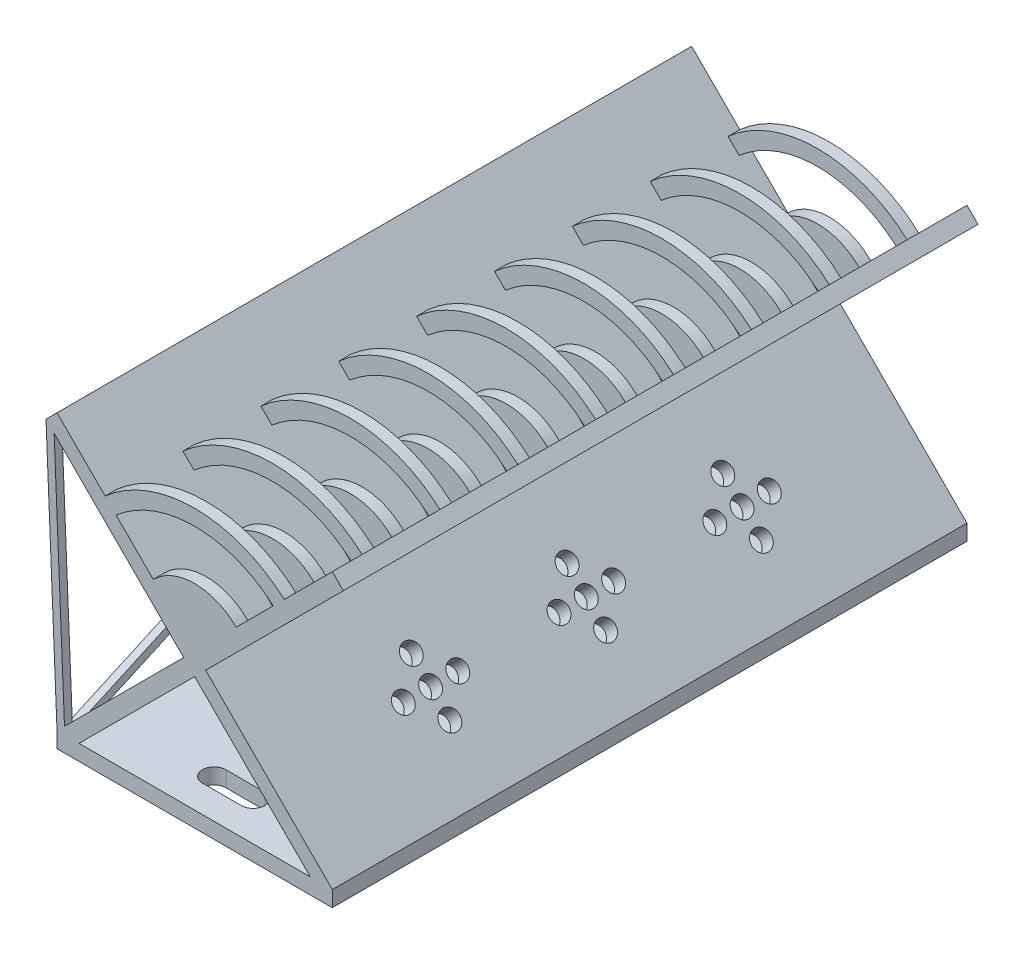
from build123d import *

# Parameters (mm, degrees)
FRAME_DEPTH                          = 207.01
FRAME_2_DEPTH                        = 207.01
SKETCH12_W                           = 89.80256121
SKETCH12_H                           = 5.113031494
BOTTOM_PLATFORM_DEPTH                = 207.01
SKETCH13_R                           = 3.81
RUBBER_PADS_1_DEPTH                  = 3.81
RUBBER_PADS_1_TAPER                  = 10
SKETCH15_R                           = 3.81
RUBBER_PADS_2_DEPTH                  = 3.81
RUBBER_PADS_2_TAPER                  = 10
CABLE_HOLES_REACH                    = 234.838
BOTTOM_SEPARATORS_DEPTH              = 3.81
BOTTOM_SEPARATORS_PATTERN_COUNT      = 9
BOTTOM_SEPARATORS_PATTERN_PITCH      = 25.4
TOP_SEPARATORS_DEPTH                 = 3.81
TOP_SEPARATORS_PATTERN_COUNT         = 9
TOP_SEPARATORS_PATTERN_PITCH         = 25.4
SPEAKER_HOLES_REACH                  = 221.321
SKETCH27_R                           = 3.175
SPEAKER_HOLES_PATTERN_1_COUNT        = 2
SPEAKER_HOLES_PATTERN_1_PITCH        = 50.8
SPEAKER_HOLES_PATTERN_2_COUNT        = 2
SPEAKER_HOLES_PATTERN_2_PITCH        = 50.8
SPEAKER_HOLES_MIRROR_COPY_1_REACH    = 221.321
SPEAKER_HOLES_MIRROR_COPY_1_SKETCH_R = 3.175
SPEAKER_HOLES_MIRROR_COPY_2_REACH    = 221.321
SPEAKER_HOLES_MIRROR_COPY_2_SKETCH_R = 3.175
EXTRUDE_THIN2_DEPTH                  = 2.54
EXTRUDE_THIN5_DEPTH                  = 2.54
EXTRUDE_THIN9_DEPTH                  = 2.54


with BuildPart() as part:
    # Sketch1 → Frame (new body)
    with BuildSketch(Plane.XY):
        Polygon((-44.901280605, 44.901280605), (44.901280605, -44.901280605), (41.309178157, -48.493383054), (-48.493383054, 41.309178157), align=None)
    extrude(amount=FRAME_DEPTH)



with BuildPart() as body_2:
    # Sketch1 → Frame 2 (new body)
    with BuildSketch(Plane.XY):
        Polygon((-44.901280605, -44.901280605), (44.901280605, 44.901280605), (48.493383054, 41.309178157), (-41.309178157, -48.493383054), align=None)
    extrude(amount=FRAME_2_DEPTH)


with BuildPart() as part_1:
    add(part.part)

    add(body_2.part)  # Bottom Platform merges body 2
    # Sketch12 → Bottom Platform (add)
    with BuildSketch(Plane.XY):
        with Locations((0, -47.457796352)):
            Rectangle(SKETCH12_W, SKETCH12_H)
    extrude(amount=BOTTOM_PLATFORM_DEPTH)

    # Sketch13 → Rubber Pads 1 (add)
    with BuildSketch(Plane(origin=(0, -50.014312099, 0), x_dir=(-1, 0, 0), z_dir=(0, -1, 0))):
        with Locations((32.201280605, -194.31)):
            Circle(SKETCH13_R)
    rubber_pads_1 = extrude(amount=RUBBER_PADS_1_DEPTH, taper=RUBBER_PADS_1_TAPER)

    # Rubber Pads 1 Mirror: Rubber Pads 1 across plane
    add(rubber_pads_1.mirror(Plane(origin=(0, 0, 0), x_dir=(0, 0, 1), z_dir=(1, 0, 0))))

    # Sketch15 → Rubber Pads 2 (add)
    with BuildSketch(Plane.XZ.offset(50.014312099)):
        with Locations((32.201280605, 12.7)):
            Circle(SKETCH15_R)
    rubber_pads_2 = extrude(amount=RUBBER_PADS_2_DEPTH, taper=RUBBER_PADS_2_TAPER)

    # Rubber Pads 2 Mirror: Rubber Pads 2 across plane
    add(rubber_pads_2.mirror(Plane(origin=(0, 0, 0), x_dir=(0, 0, 1), z_dir=(1, 0, 0))))

    # Sketch21 → Cable Holes (cut, up to next)
    with BuildSketch(Plane.XZ.offset(50.014312099), mode=Mode.PRIVATE) as cable_holes_sk1:
        with BuildLine():
            Line((6.35, 8.89), (-6.35, 8.89))
            ThreePointArc((-6.35, 8.89), (-10.16, 12.7), (-6.35, 16.51))
            Line((-6.35, 16.51), (6.35, 16.51))
            ThreePointArc((6.35, 16.51), (10.16, 12.7), (6.35, 8.89))
        make_face()
    cable_holes_tool1 = extrude(cable_holes_sk1.sketch, amount=-CABLE_HOLES_REACH, mode=Mode.PRIVATE) & part_1.part
    # Sketch21 → Cable Holes (cut, up to next)
    with BuildSketch(Plane.XZ.offset(50.014312099), mode=Mode.PRIVATE) as cable_holes_sk2:
        with BuildLine():
            Line((6.35, 190.5), (-6.35, 190.5))
            ThreePointArc((-6.35, 190.5), (-10.16, 194.31), (-6.35, 198.12))
            Line((-6.35, 198.12), (6.35, 198.12))
            ThreePointArc((6.35, 198.12), (10.16, 194.31), (6.35, 190.5))
        make_face()
    cable_holes_tool2 = extrude(cable_holes_sk2.sketch, amount=-CABLE_HOLES_REACH, mode=Mode.PRIVATE) & part_1.part
    add(cable_holes_tool1.solids().sort_by_distance((0, -50.014312, 12.7))[0], mode=Mode.SUBTRACT)
    add(cable_holes_tool2.solids().sort_by_distance((0, -50.014312, 194.31))[0], mode=Mode.SUBTRACT)

    # Sketch23 → Bottom Separators (add)
    with BuildSketch(Plane.XY.offset(207.01)):
        with BuildLine():
            Line((13.516185422, 13.516185422), (0, 0))
            Line((0, 0), (-13.516185422, 13.516185422))
            ThreePointArc((-13.516185422, 13.516185422), (0, 19.114772736), (13.516185422, 13.516185422))
        make_face()
    bottom_separators = extrude(amount=-BOTTOM_SEPARATORS_DEPTH)

    # Bottom Separators Pattern: Bottom Separators ×9
    with Locations(*[(0, 0, -i * BOTTOM_SEPARATORS_PATTERN_PITCH) for i in range(1, BOTTOM_SEPARATORS_PATTERN_COUNT)]):
        add(bottom_separators)

    # Sketch25 → Top Separators (add)
    with BuildSketch(Plane.XY.offset(207.01)):
        with BuildLine():
            Line((-29.208733014, 29.208733014), (-25.616630565, 25.616630565))
            ThreePointArc((-25.616630565, 25.616630565), (0, 35.281810324), (25.616630565, 25.616630565))
            Line((25.616630565, 25.616630565), (29.208733014, 29.208733014))
            ThreePointArc((29.208733014, 29.208733014), (0, 40.361810324), (-29.208733014, 29.208733014))
        make_face()
    top_separators = extrude(amount=-TOP_SEPARATORS_DEPTH)

    # Top Separators Pattern: Top Separators ×9
    with Locations(*[(0, 0, -i * TOP_SEPARATORS_PATTERN_PITCH) for i in range(1, TOP_SEPARATORS_PATTERN_COUNT)]):
        add(top_separators)

    # Sketch27 → Speaker Holes (cut, up to next)
    with BuildSketch(Plane(origin=(0, 0, 0), x_dir=(0, 0, -1), z_dir=(0.7071067811865533, 0.7071067811865418, 0)), mode=Mode.PRIVATE) as speaker_holes_sk1:
        with Locations(Location((-112.395, -34.29, 0), (0, 0, 90))):
            Circle(SKETCH27_R)
    speaker_holes_tool1 = extrude(speaker_holes_sk1.sketch, amount=-SPEAKER_HOLES_REACH, mode=Mode.PRIVATE) & part_1.part
    # Sketch27 → Speaker Holes (cut, up to next)
    with BuildSketch(Plane(origin=(0, 0, 0), x_dir=(0, 0, -1), z_dir=(0.7071067811865533, 0.7071067811865418, 0)), mode=Mode.PRIVATE) as speaker_holes_sk2:
        with Locations(Location((-103.505, -34.29, 0), (0, 0, 90))):
            Circle(SKETCH27_R)
    speaker_holes_tool2 = extrude(speaker_holes_sk2.sketch, amount=-SPEAKER_HOLES_REACH, mode=Mode.PRIVATE) & part_1.part
    # Sketch27 → Speaker Holes (cut, up to next)
    with BuildSketch(Plane(origin=(0, 0, 0), x_dir=(0, 0, -1), z_dir=(0.7071067811865533, 0.7071067811865418, 0)), mode=Mode.PRIVATE) as speaker_holes_sk3:
        with Locations(Location((-94.615, -34.29, 0), (0, 0, 90))):
            Circle(SKETCH27_R)
    speaker_holes_tool3 = extrude(speaker_holes_sk3.sketch, amount=-SPEAKER_HOLES_REACH, mode=Mode.PRIVATE) & part_1.part
    # Sketch27 → Speaker Holes (cut, up to next)
    with BuildSketch(Plane(origin=(0, 0, 0), x_dir=(0, 0, -1), z_dir=(0.7071067811865533, 0.7071067811865418, 0)), mode=Mode.PRIVATE) as speaker_holes_sk4:
        with Locations(Location((-103.505, -25.4, 0), (0, 0, 90))):
            Circle(SKETCH27_R)
    speaker_holes_tool4 = extrude(speaker_holes_sk4.sketch, amount=-SPEAKER_HOLES_REACH, mode=Mode.PRIVATE) & part_1.part
    # Sketch27 → Speaker Holes (cut, up to next)
    with BuildSketch(Plane(origin=(0, 0, 0), x_dir=(0, 0, -1), z_dir=(0.7071067811865533, 0.7071067811865418, 0)), mode=Mode.PRIVATE) as speaker_holes_sk5:
        with Locations(Location((-103.505, -43.18, 0), (0, 0, 90))):
            Circle(SKETCH27_R)
    speaker_holes_tool5 = extrude(speaker_holes_sk5.sketch, amount=-SPEAKER_HOLES_REACH, mode=Mode.PRIVATE) & part_1.part
    speaker_holes_1 = speaker_holes_tool1.solids().sort_by_distance((24.246692, -24.246692, 112.395))[0]
    add(speaker_holes_1, mode=Mode.SUBTRACT)
    speaker_holes_2 = speaker_holes_tool2.solids().sort_by_distance((24.246692, -24.246692, 103.505))[0]
    add(speaker_holes_2, mode=Mode.SUBTRACT)
    speaker_holes_3 = speaker_holes_tool3.solids().sort_by_distance((24.246692, -24.246692, 94.615))[0]
    add(speaker_holes_3, mode=Mode.SUBTRACT)
    speaker_holes_4 = speaker_holes_tool4.solids().sort_by_distance((17.960512, -17.960512, 103.505))[0]
    add(speaker_holes_4, mode=Mode.SUBTRACT)
    speaker_holes_5 = speaker_holes_tool5.solids().sort_by_distance((30.532871, -30.532871, 103.505))[0]
    add(speaker_holes_5, mode=Mode.SUBTRACT)
    speaker_holes = speaker_holes_1 + speaker_holes_2 + speaker_holes_3 + speaker_holes_4 + speaker_holes_5  # Speaker Holes as one shape, for the pattern or mirror that repeats it

    # Speaker Holes Pattern 1: Speaker Holes ×2
    with Locations(*[(0, 0, i * SPEAKER_HOLES_PATTERN_1_PITCH) for i in range(1, SPEAKER_HOLES_PATTERN_1_COUNT)]):
        add(speaker_holes, mode=Mode.SUBTRACT)

    # Speaker Holes Pattern 2: Speaker Holes ×2
    with Locations(*[(0, 0, -i * SPEAKER_HOLES_PATTERN_2_PITCH) for i in range(1, SPEAKER_HOLES_PATTERN_2_COUNT)]):
        add(speaker_holes, mode=Mode.SUBTRACT)

    # Speaker Holes Mirror: Speaker Holes across plane
    add(speaker_holes.mirror(Plane(origin=(0, 0, 0), x_dir=(0, 0, 1), z_dir=(1, 0, 0))), mode=Mode.SUBTRACT)

    # Speaker Holes Mirror copy 1 sketch → Speaker Holes Mirror copy 1 (cut, up to next)
    with BuildSketch(Plane(origin=(0, 0, 50.8), x_dir=(0, 0, -1), z_dir=(-0.7071067811865533, 0.7071067811865418, 0)), mode=Mode.PRIVATE) as speaker_holes_mirror_copy_1_sk1:
        with Locations((-112.395, 34.29)):
            Circle(SPEAKER_HOLES_MIRROR_COPY_1_SKETCH_R)
    speaker_holes_mirror_copy_1_tool1 = extrude(speaker_holes_mirror_copy_1_sk1.sketch, amount=-SPEAKER_HOLES_MIRROR_COPY_1_REACH, mode=Mode.PRIVATE) & part_1.part
    # Speaker Holes Mirror copy 1 sketch → Speaker Holes Mirror copy 1 (cut, up to next)
    with BuildSketch(Plane(origin=(0, 0, 50.8), x_dir=(0, 0, -1), z_dir=(-0.7071067811865533, 0.7071067811865418, 0)), mode=Mode.PRIVATE) as speaker_holes_mirror_copy_1_sk2:
        with Locations((-103.505, 34.29)):
            Circle(SPEAKER_HOLES_MIRROR_COPY_1_SKETCH_R)
    speaker_holes_mirror_copy_1_tool2 = extrude(speaker_holes_mirror_copy_1_sk2.sketch, amount=-SPEAKER_HOLES_MIRROR_COPY_1_REACH, mode=Mode.PRIVATE) & part_1.part
    # Speaker Holes Mirror copy 1 sketch → Speaker Holes Mirror copy 1 (cut, up to next)
    with BuildSketch(Plane(origin=(0, 0, 50.8), x_dir=(0, 0, -1), z_dir=(-0.7071067811865533, 0.7071067811865418, 0)), mode=Mode.PRIVATE) as speaker_holes_mirror_copy_1_sk3:
        with Locations((-94.615, 34.29)):
            Circle(SPEAKER_HOLES_MIRROR_COPY_1_SKETCH_R)
    speaker_holes_mirror_copy_1_tool3 = extrude(speaker_holes_mirror_copy_1_sk3.sketch, amount=-SPEAKER_HOLES_MIRROR_COPY_1_REACH, mode=Mode.PRIVATE) & part_1.part
    # Speaker Holes Mirror copy 1 sketch → Speaker Holes Mirror copy 1 (cut, up to next)
    with BuildSketch(Plane(origin=(0, 0, 50.8), x_dir=(0, 0, -1), z_dir=(-0.7071067811865533, 0.7071067811865418, 0)), mode=Mode.PRIVATE) as speaker_holes_mirror_copy_1_sk4:
        with Locations((-103.505, 25.4)):
            Circle(SPEAKER_HOLES_MIRROR_COPY_1_SKETCH_R)
    speaker_holes_mirror_copy_1_tool4 = extrude(speaker_holes_mirror_copy_1_sk4.sketch, amount=-SPEAKER_HOLES_MIRROR_COPY_1_REACH, mode=Mode.PRIVATE) & part_1.part
    # Speaker Holes Mirror copy 1 sketch → Speaker Holes Mirror copy 1 (cut, up to next)
    with BuildSketch(Plane(origin=(0, 0, 50.8), x_dir=(0, 0, -1), z_dir=(-0.7071067811865533, 0.7071067811865418, 0)), mode=Mode.PRIVATE) as speaker_holes_mirror_copy_1_sk5:
        with Locations((-103.505, 43.18)):
            Circle(SPEAKER_HOLES_MIRROR_COPY_1_SKETCH_R)
    speaker_holes_mirror_copy_1_tool5 = extrude(speaker_holes_mirror_copy_1_sk5.sketch, amount=-SPEAKER_HOLES_MIRROR_COPY_1_REACH, mode=Mode.PRIVATE) & part_1.part
    add(speaker_holes_mirror_copy_1_tool1.solids().sort_by_distance((-24.246692, -24.246692, 163.195))[0], mode=Mode.SUBTRACT)
    add(speaker_holes_mirror_copy_1_tool2.solids().sort_by_distance((-24.246692, -24.246692, 154.305))[0], mode=Mode.SUBTRACT)
    add(speaker_holes_mirror_copy_1_tool3.solids().sort_by_distance((-24.246692, -24.246692, 145.415))[0], mode=Mode.SUBTRACT)
    add(speaker_holes_mirror_copy_1_tool4.solids().sort_by_distance((-17.960512, -17.960512, 154.305))[0], mode=Mode.SUBTRACT)
    add(speaker_holes_mirror_copy_1_tool5.solids().sort_by_distance((-30.532871, -30.532871, 154.305))[0], mode=Mode.SUBTRACT)

    # Speaker Holes Mirror copy 2 sketch → Speaker Holes Mirror copy 2 (cut, up to next)
    with BuildSketch(Plane(origin=(0, 0, -50.8), x_dir=(0, 0, -1), z_dir=(-0.7071067811865533, 0.7071067811865418, 0)), mode=Mode.PRIVATE) as speaker_holes_mirror_copy_2_sk1:
        with Locations((-112.395, 34.29)):
            Circle(SPEAKER_HOLES_MIRROR_COPY_2_SKETCH_R)
    speaker_holes_mirror_copy_2_tool1 = extrude(speaker_holes_mirror_copy_2_sk1.sketch, amount=-SPEAKER_HOLES_MIRROR_COPY_2_REACH, mode=Mode.PRIVATE) & part_1.part
    # Speaker Holes Mirror copy 2 sketch → Speaker Holes Mirror copy 2 (cut, up to next)
    with BuildSketch(Plane(origin=(0, 0, -50.8), x_dir=(0, 0, -1), z_dir=(-0.7071067811865533, 0.7071067811865418, 0)), mode=Mode.PRIVATE) as speaker_holes_mirror_copy_2_sk2:
        with Locations((-103.505, 34.29)):
            Circle(SPEAKER_HOLES_MIRROR_COPY_2_SKETCH_R)
    speaker_holes_mirror_copy_2_tool2 = extrude(speaker_holes_mirror_copy_2_sk2.sketch, amount=-SPEAKER_HOLES_MIRROR_COPY_2_REACH, mode=Mode.PRIVATE) & part_1.part
    # Speaker Holes Mirror copy 2 sketch → Speaker Holes Mirror copy 2 (cut, up to next)
    with BuildSketch(Plane(origin=(0, 0, -50.8), x_dir=(0, 0, -1), z_dir=(-0.7071067811865533, 0.7071067811865418, 0)), mode=Mode.PRIVATE) as speaker_holes_mirror_copy_2_sk3:
        with Locations((-94.615, 34.29)):
            Circle(SPEAKER_HOLES_MIRROR_COPY_2_SKETCH_R)
    speaker_holes_mirror_copy_2_tool3 = extrude(speaker_holes_mirror_copy_2_sk3.sketch, amount=-SPEAKER_HOLES_MIRROR_COPY_2_REACH, mode=Mode.PRIVATE) & part_1.part
    # Speaker Holes Mirror copy 2 sketch → Speaker Holes Mirror copy 2 (cut, up to next)
    with BuildSketch(Plane(origin=(0, 0, -50.8), x_dir=(0, 0, -1), z_dir=(-0.7071067811865533, 0.7071067811865418, 0)), mode=Mode.PRIVATE) as speaker_holes_mirror_copy_2_sk4:
        with Locations((-103.505, 25.4)):
            Circle(SPEAKER_HOLES_MIRROR_COPY_2_SKETCH_R)
    speaker_holes_mirror_copy_2_tool4 = extrude(speaker_holes_mirror_copy_2_sk4.sketch, amount=-SPEAKER_HOLES_MIRROR_COPY_2_REACH, mode=Mode.PRIVATE) & part_1.part
    # Speaker Holes Mirror copy 2 sketch → Speaker Holes Mirror copy 2 (cut, up to next)
    with BuildSketch(Plane(origin=(0, 0, -50.8), x_dir=(0, 0, -1), z_dir=(-0.7071067811865533, 0.7071067811865418, 0)), mode=Mode.PRIVATE) as speaker_holes_mirror_copy_2_sk5:
        with Locations((-103.505, 43.18)):
            Circle(SPEAKER_HOLES_MIRROR_COPY_2_SKETCH_R)
    speaker_holes_mirror_copy_2_tool5 = extrude(speaker_holes_mirror_copy_2_sk5.sketch, amount=-SPEAKER_HOLES_MIRROR_COPY_2_REACH, mode=Mode.PRIVATE) & part_1.part
    add(speaker_holes_mirror_copy_2_tool1.solids().sort_by_distance((-24.246692, -24.246692, 61.595))[0], mode=Mode.SUBTRACT)
    add(speaker_holes_mirror_copy_2_tool2.solids().sort_by_distance((-24.246692, -24.246692, 52.705))[0], mode=Mode.SUBTRACT)
    add(speaker_holes_mirror_copy_2_tool3.solids().sort_by_distance((-24.246692, -24.246692, 43.815))[0], mode=Mode.SUBTRACT)
    add(speaker_holes_mirror_copy_2_tool4.solids().sort_by_distance((-17.960512, -17.960512, 52.705))[0], mode=Mode.SUBTRACT)
    add(speaker_holes_mirror_copy_2_tool5.solids().sort_by_distance((-30.532871, -30.532871, 52.705))[0], mode=Mode.SUBTRACT)

    # Sketch38 → Extrude-Thin2 (add)
    with BuildSketch(Plane(origin=(0, 0, 0), x_dir=(-1, 0, 0), z_dir=(0, 0, -1))):
        Polygon((48.493383054, 41.309178157), (44.901280605, -44.901280605), (42.3634826, -44.795539022), (45.955585048, 41.41491974), align=None)
    extrude(amount=-EXTRUDE_THIN2_DEPTH)

    # Sketch40 → Extrude-Thin5 (add)
    with BuildSketch(Plane.XY.offset(207.01)):
        Polygon((-48.493383054, 41.309178157), (-44.901280605, -44.901280605), (-42.3634826, -44.795539022), (-45.955585048, 41.41491974), align=None)
    extrude(amount=-EXTRUDE_THIN5_DEPTH)

    # Sketch48 → Extrude-Thin9 (add)
    with BuildSketch(Plane(origin=(-46.691106349, -1.945462765, 0), x_dir=(0, 0, 1), z_dir=(-0.9991330730923522, -0.04163054471217437, 0))):
        Polygon((2.54, 43.29217207), (204.47, -42.993089707), (203.471948823, -45.32878957), (1.541948823, 40.956472208), align=None)
        Polygon((2.54, -42.993089707), (204.47, 43.29217207), (205.468051177, 40.956472208), (3.538051177, -45.32878957), align=None)
    extrude(amount=-EXTRUDE_THIN9_DEPTH)


solid = part_1.part
